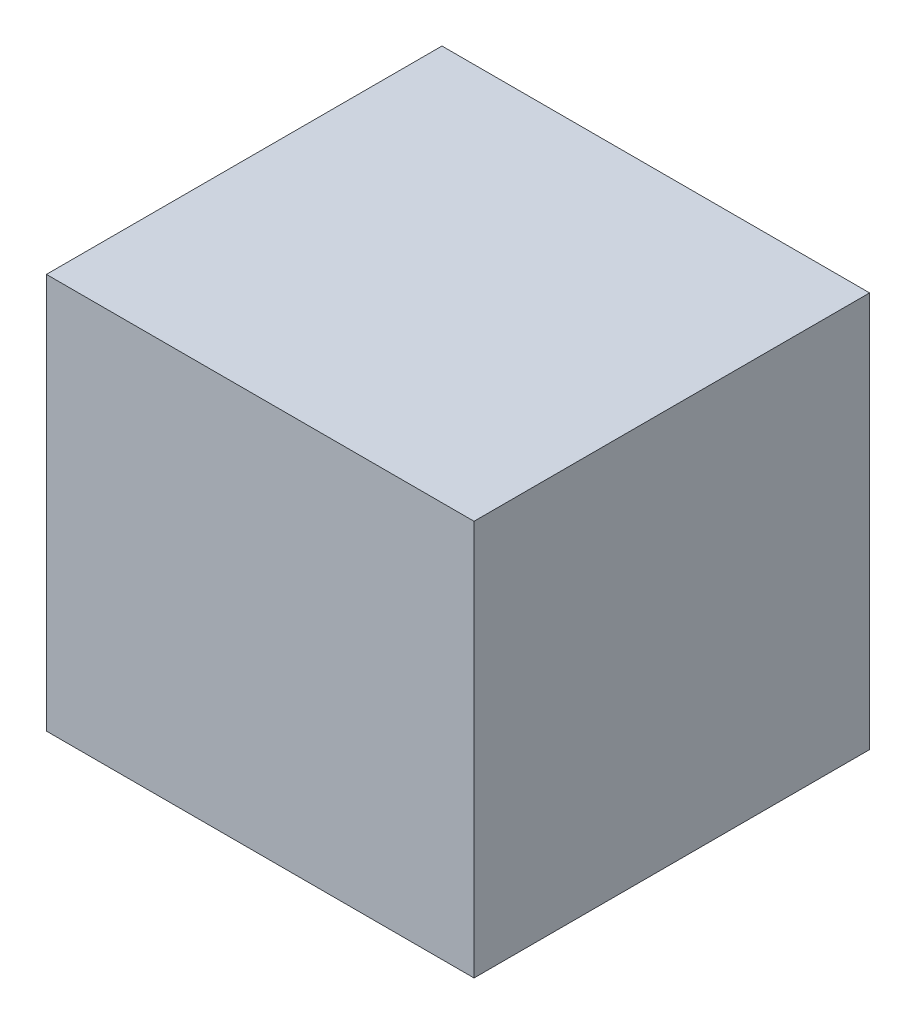
from build123d import *

# Parameters (mm, degrees)
MTG_REDUKTOR_GOVDE_37X37X40_1_START = 18.5
SKETCH1_W                           = 40
SKETCH1_H                           = 37
MTG_REDUKTOR_GOVDE_37X37X40_1_DEPTH = 37


with BuildPart() as part:
    # Sketch1 → MTG_reduktor_govde_37x37x40_1 (new body)
    with BuildSketch(Plane.XY.offset(MTG_REDUKTOR_GOVDE_37X37X40_1_START)):
        with Locations((28, 0)):
            Rectangle(SKETCH1_W, SKETCH1_H)
    extrude(amount=-MTG_REDUKTOR_GOVDE_37X37X40_1_DEPTH)


solid = part.part
